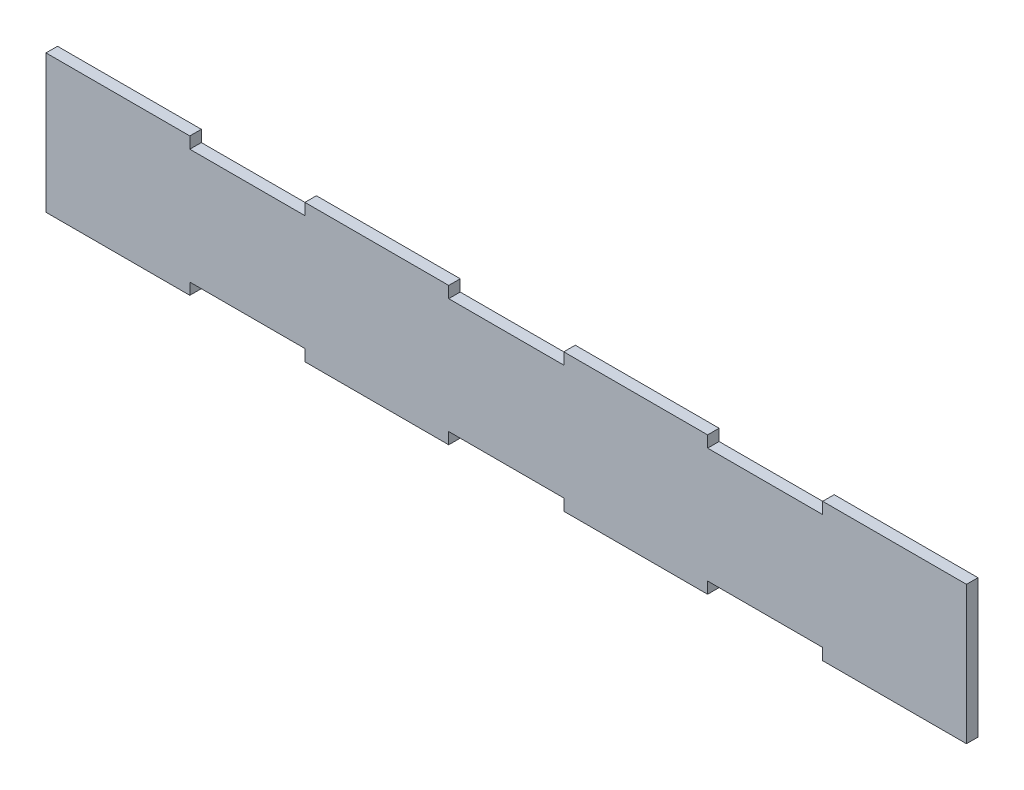
from build123d import *

# Parameters (mm, degrees)
EXTRUDE_1_DEPTH = 2


with BuildPart() as part:
    # Эскиз1 → Бобышка-Вытянуть1 (new body)
    with BuildSketch(Plane.XY):
        Polygon((135, 2), (135, 0), (160, 0), (160, 2), (160, 22), (160, 24), (135, 24), (135, 22), (115, 22), (115, 24), (90, 24), (90, 22), (70, 22), (70, 24), (45, 24), (45, 22), (25.389163858, 22), (25, 22), (25, 24), (21.983225621, 24), (0, 24), (0, 22), (0, 2), (0, 0), (25, 0), (25, 2), (45, 2), (45, 0), (70, 0), (70, 2), (90, 2), (90, 0), (115, 0), (115, 2), align=None)
    extrude(amount=EXTRUDE_1_DEPTH)


solid = part.part
